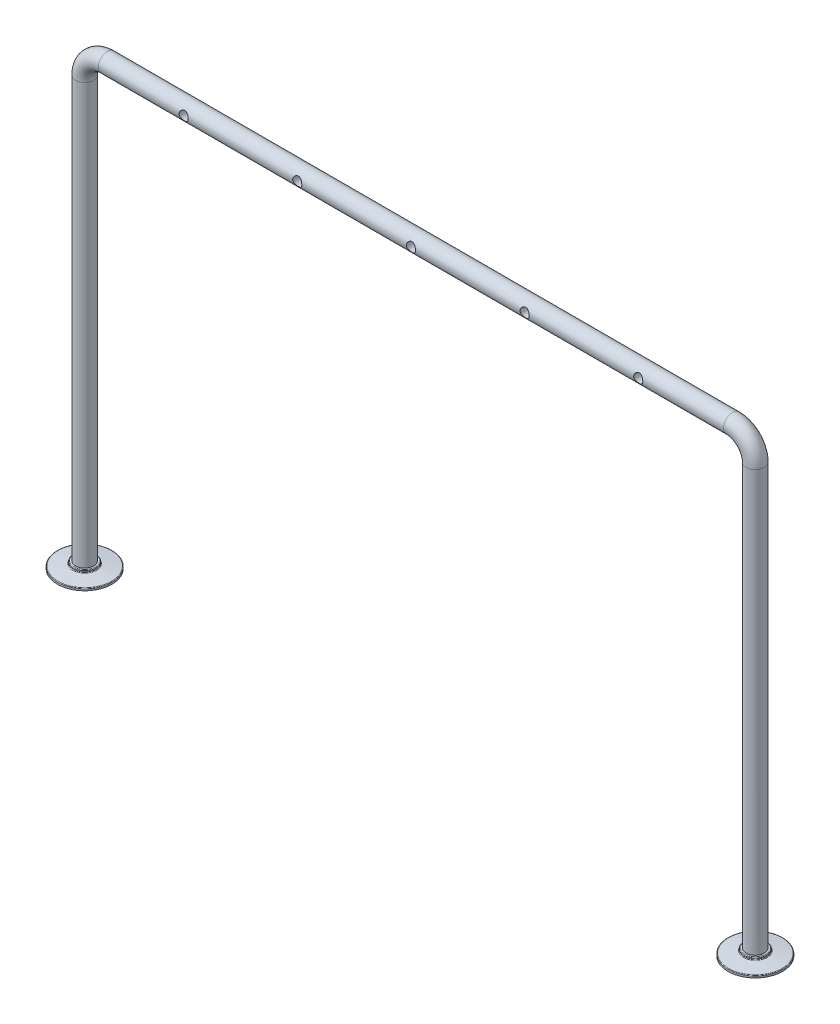
from build123d import *

# Parameters (mm, degrees)
SKETCH3_R          = 40
SKETCH8_R          = 20
CUT_EXTRUDE3_DEPTH = 100
LPATTERN1_COUNT    = 5
LPATTERN1_PITCH    = 500


with BuildPart() as part:
    # Sweep1: sweep along a path in Sketch1
    with BuildLine(Plane.XY) as sweep1_path:
        Line((1475, 0), (1475, 1850))
        ThreePointArc((1475, 1850), (1445.710678119, 1920.710678119), (1375, 1950))
        Line((1375, 1950), (-1375, 1950))
        ThreePointArc((-1375, 1950), (-1445.710678119, 1920.710678119), (-1475, 1850))
        Line((-1475, 1850), (-1475, 0))
    # Sketch3 → Sweep1 (sweep)
    with BuildSketch(Plane(origin=(0, 0, 0), x_dir=(1, 0, 0), z_dir=(0, 1, 0))):
        with Locations((-1475, 0)):
            Circle(SKETCH3_R)
    sweep(path=sweep1_path.line)

    # Sketch4 → Revolve1 (revolve)
    with BuildSketch(Plane.XY, mode=Mode.PRIVATE) as revolve1_sk:
        with BuildLine():
            Line((-1475, 0), (-1475, -30))
            Line((-1475, -30), (-1595, -30))
            Line((-1595, -30), (-1595, -22.601886205))
            ThreePointArc((-1595, -22.601886205), (-1594.266361865, -20.636280981), (-1592.424264069, -19.632037724))
            Line((-1592.424264069, -19.632037724), (-1527.575735931, -10.367962276))
            ThreePointArc((-1527.575735931, -10.367962276), (-1525.733638135, -9.363719019), (-1525, -7.398113795))
            Line((-1525, -7.398113795), (-1525, -3))
            ThreePointArc((-1525, -3), (-1524.121320344, -0.878679656), (-1522, 0))
            Line((-1522, 0), (-1475, 0))
        make_face()
    revolve1 = revolve(revolve1_sk.sketch.rotate(Axis((-1475, 0, 0), (0, -1, 0)), 270), axis=Axis((-1475, 0, 0), (0, -1, 0)))

    # Mirror1: Revolve1 across plane
    add(revolve1.mirror(Plane(origin=(0, 0, 0), x_dir=(0, 0, 1), z_dir=(1, 0, 0))))

    # Sketch8 → Cut-Extrude3 (cut)
    with BuildSketch(Plane.XY):
        with Locations((-1000, 1950)):
            Circle(SKETCH8_R)
    cut_extrude3 = extrude(amount=CUT_EXTRUDE3_DEPTH, mode=Mode.SUBTRACT)

    # LPattern1: Cut-Extrude3 ×5
    with Locations(*[(i * LPATTERN1_PITCH, 0, 0) for i in range(1, LPATTERN1_COUNT)]):
        add(cut_extrude3, mode=Mode.SUBTRACT)


solid = part.part
